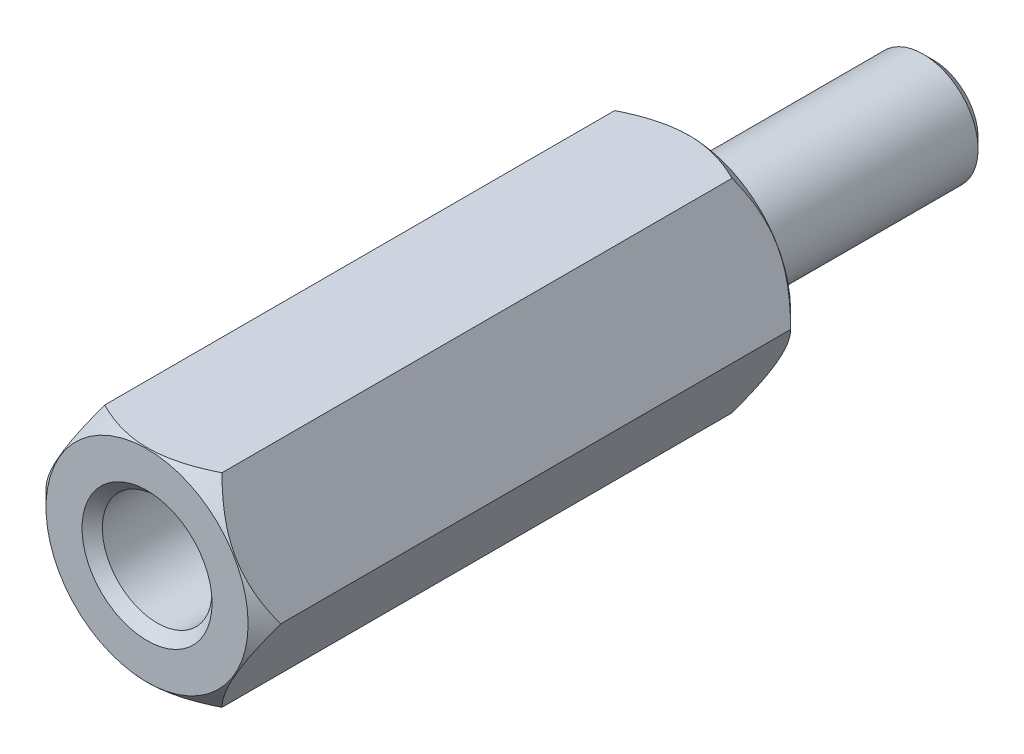
from build123d import *

# Parameters (mm, degrees)
HEX_2_DEPTH                 = 6.675
TAP_DRILL_FOR_M3X0_5_TAP1_D = 2.7
THREAD_DEPTH                = 6
THREAD_DEPTH_BACK           = 2
SKETCH8_R                   = 1.35
INNERCHAMFER_SIZE           = 0.25


with BuildPart() as part:
    # Sketch1 → HEX 2 (new, symmetric)
    with BuildSketch(Plane.XY):
        Polygon((2.886751346, 0), (1.443375673, 2.5), (-1.443375673, 2.5), (-2.886751346, 0), (-1.443375673, -2.5), (1.443375673, -2.5), align=None)
    extrude(amount=HEX_2_DEPTH, both=True)

    # Tap Drill for M3x0.5 Tap1 (through all)
    with Locations(Plane.XY.offset(6.675)):
        with Locations((0, 0)):
            Hole(TAP_DRILL_FOR_M3X0_5_TAP1_D / 2)

    # Sketch7 → HexChamfer (revolve, cut)
    with BuildSketch(Plane(origin=(0, 0, 0), x_dir=(1, 0, 0), z_dir=(0, 1, 0)), mode=Mode.PRIVATE) as hexchamfer_sk:
        Polygon((-2.886751346, 6.675), (-2.886751346, 6.275), (-2.486751346, 6.675), align=None)
    hexchamfer = revolve(hexchamfer_sk.sketch.rotate(Axis((0, 0, 15.266742202), (0, 0, -1)), 180), axis=Axis((0, 0, 15.266742202), (0, 0, -1)), mode=Mode.SUBTRACT)

    # Mirror1: HexChamfer across plane
    add(hexchamfer.mirror(Plane.XY), mode=Mode.SUBTRACT)

    # Sketch8 → Thread (add, two sides: drawn at the far end of the back side and taken through both)
    with BuildSketch(Plane(origin=(0, 0, -6.675), x_dir=(-1, 0, 0), z_dir=(0, 0, -1)).offset(-THREAD_DEPTH_BACK)):
        with Locations(Location((0, 0, 0), (0, 0, 180))):
            Circle(SKETCH8_R)
    extrude(amount=THREAD_DEPTH + THREAD_DEPTH_BACK)

    # InnerChamfer
    innerchamfer_edges = [part.edges().sort_by_distance(p)[0] for p in [
        (1.35, 0, 6.675),
        (-1.35, 0, -6.675),
        (-1.35, 0, -12.675),
    ]]
    chamfer(innerchamfer_edges, length=INNERCHAMFER_SIZE)


solid = part.part
